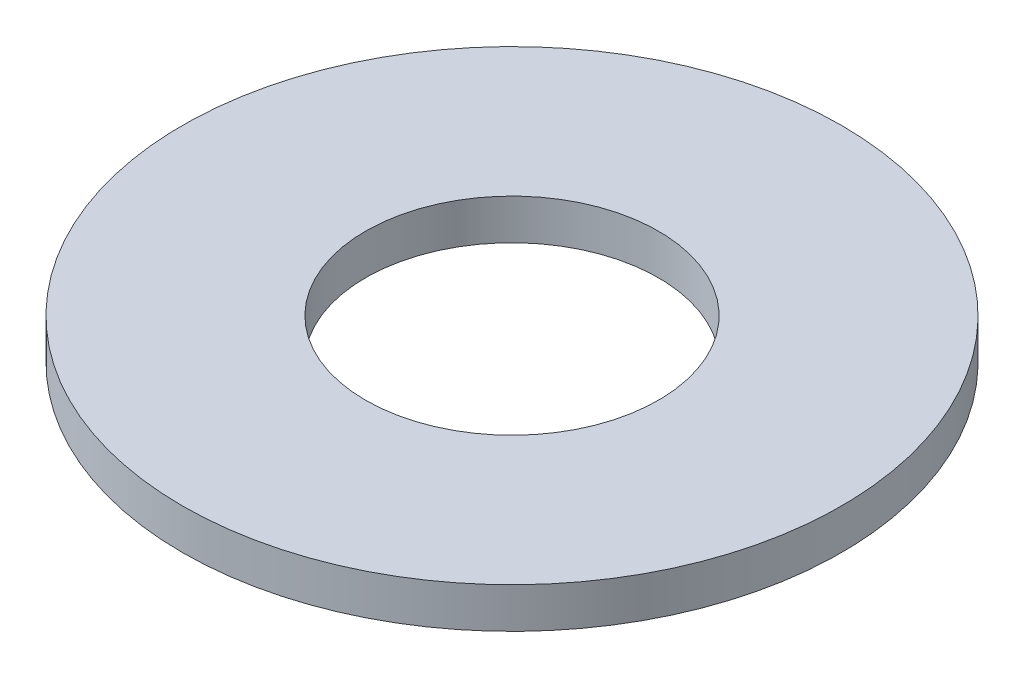
from build123d import *

# Parameters (mm, degrees)
SKETCH1_R           = 14.2875
BOSS_EXTRUDE1_DEPTH = 1.7526
SKETCH5_R           = 6.35
CUT_EXTRUDE1_DEPTH  = 21.281442731


with BuildPart() as part:
    # Sketch1 → Boss-Extrude1 (new body)
    with BuildSketch(Plane(origin=(0, 0, 0), x_dir=(1, 0, 0), z_dir=(0, 1, 0))):
        with Locations(Location((0, 0, 0), (0, 0, 270))):
            Circle(SKETCH1_R)
    extrude(amount=BOSS_EXTRUDE1_DEPTH)

    # Sketch5 → Cut-Extrude1 (cut, through all)
    with BuildSketch(Plane(origin=(0, 1.7526, 0), x_dir=(-1, 0, 0), z_dir=(0, 1, 0))):
        with Locations(Location((0, 0, 0), (0, 0, 90))):
            Circle(SKETCH5_R)
    extrude(amount=-CUT_EXTRUDE1_DEPTH, mode=Mode.SUBTRACT)


solid = part.part
